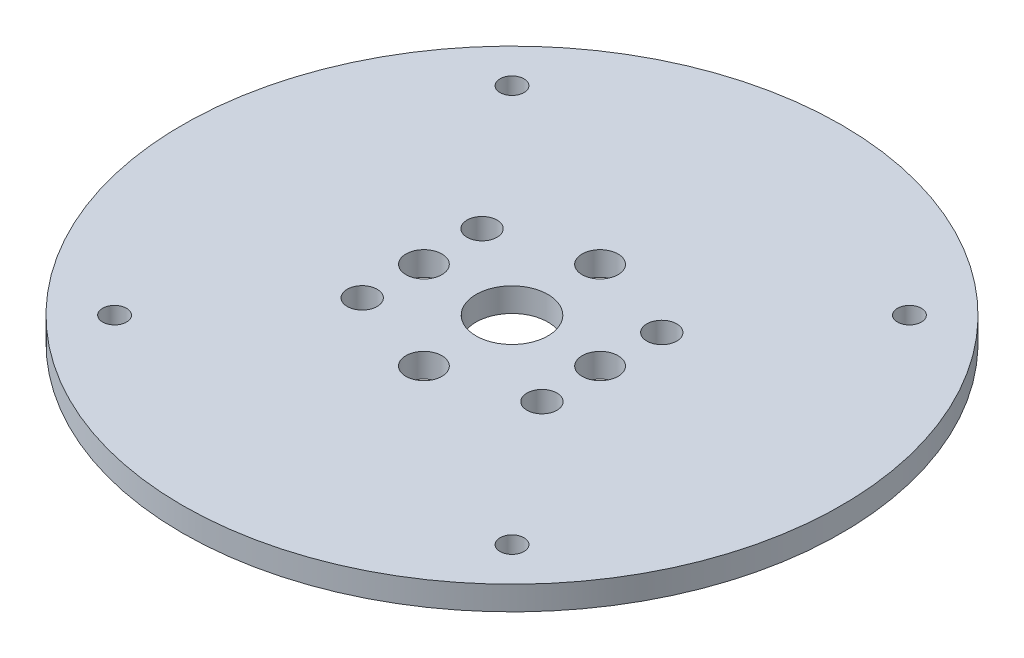
from build123d import *

# Parameters (mm, degrees)
CROQUIS_BASE_R          = 27.5
CROQUIS_BASE_R_2        = 3
CROQUIS_BASE_R_3        = 1.5
CROQUIS_BASE_R_4        = 1.25
CROQUIS_BASE_R_5        = 1
SALIENTE_EXTRUIR1_DEPTH = 2


with BuildPart() as part:
    # Croquis base → Saliente-Extruir1 (new body)
    with BuildSketch(Plane(origin=(0, 0, 0), x_dir=(1, 0, 0), z_dir=(0, 1, 0))):
        with Locations(Location((1.148439705, 1.092857143, 0), (0, 0, 270))):
            Circle(CROQUIS_BASE_R)
        with Locations(Location((1.148439705, 1.092857143, 0), (0, 0, 270))):
            Circle(CROQUIS_BASE_R_2, mode=Mode.SUBTRACT)
        with Locations(Location((-6.201560295, 1.092857143, 0), (0, 0, 270))):
            Circle(CROQUIS_BASE_R_3, mode=Mode.SUBTRACT)
        with Locations(Location((1.148439705, 8.442857143, 0), (0, 0, 270))):
            Circle(CROQUIS_BASE_R_3, mode=Mode.SUBTRACT)
        with Locations(Location((8.498439705, 1.092857143, 0), (0, 0, 270))):
            Circle(CROQUIS_BASE_R_3, mode=Mode.SUBTRACT)
        with Locations(Location((1.148439705, -6.257142857, 0), (0, 0, 270))):
            Circle(CROQUIS_BASE_R_3, mode=Mode.SUBTRACT)
        with Locations(Location((-6.351560295, 6.092857143, 0), (0, 0, 270))):
            Circle(CROQUIS_BASE_R_4, mode=Mode.SUBTRACT)
        with Locations(Location((8.648439705, 6.092857143, 0), (0, 0, 270))):
            Circle(CROQUIS_BASE_R_4, mode=Mode.SUBTRACT)
        with Locations(Location((8.648439705, -3.907142857, 0), (0, 0, 270))):
            Circle(CROQUIS_BASE_R_4, mode=Mode.SUBTRACT)
        with Locations(Location((-6.351560295, -3.907142857, 0), (0, 0, 270))):
            Circle(CROQUIS_BASE_R_4, mode=Mode.SUBTRACT)
        with Locations(Location((-15.433060295, 17.674357143, 0), (0, 0, 270))):
            Circle(CROQUIS_BASE_R_5, mode=Mode.SUBTRACT)
        with Locations(Location((17.729939705, 17.674357143, 0), (0, 0, 270))):
            Circle(CROQUIS_BASE_R_5, mode=Mode.SUBTRACT)
        with Locations(Location((17.729939705, -15.488642857, 0), (0, 0, 270))):
            Circle(CROQUIS_BASE_R_5, mode=Mode.SUBTRACT)
        with Locations(Location((-15.433060295, -15.488642857, 0), (0, 0, 270))):
            Circle(CROQUIS_BASE_R_5, mode=Mode.SUBTRACT)
    extrude(amount=SALIENTE_EXTRUIR1_DEPTH)


solid = part.part
